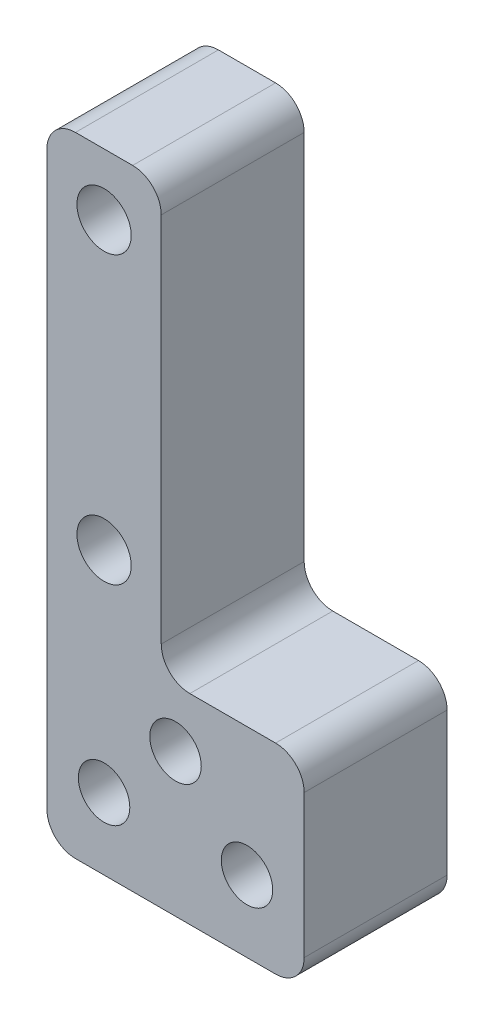
from build123d import *

# Parameters (mm, degrees)
SKETCH1_W           = 10.16
SKETCH1_H           = 38.1
SKETCH1_R           = 2.413
SKETCH1_R_2         = 2.286
BOSS_EXTRUDE1_DEPTH = 12.7
FILLET1_R           = 2.54


with BuildPart() as part:
    # Sketch1 → Boss-Extrude1 (new body)
    # profile 1 of 2: a face of its own
    with BuildSketch(Plane.XY):
        with Locations((0, -13.589)):
            Rectangle(SKETCH1_W, SKETCH1_H)
        with Locations((0, -25.4)):
            Circle(SKETCH1_R, mode=Mode.SUBTRACT)
        Circle(SKETCH1_R, mode=Mode.SUBTRACT)
    # profile 2 of 2: a face of its own
    with BuildSketch(Plane.XY):
        Polygon((5.08, -32.639), (-5.08, -32.639), (-5.08, -50.419), (17.78, -50.419), (17.78, -32.639), align=None)
        with Locations((0, -44.069)):
            Circle(SKETCH1_R_2, mode=Mode.SUBTRACT)
        with Locations((6.35, -37.719)):
            Circle(SKETCH1_R_2, mode=Mode.SUBTRACT)
        with Locations((12.7, -44.069)):
            Circle(SKETCH1_R_2, mode=Mode.SUBTRACT)
    extrude(amount=BOSS_EXTRUDE1_DEPTH)

    # Fillet1
    fillet1_edges = [part.edges().sort_by_distance(p)[0] for p in [
        (17.78, -50.419, 6.35),
        (-5.08, -50.419, 6.35),
        (-5.08, 5.461, 6.35),
        (5.08, 5.461, 6.35),
        (5.08, -32.639, 6.35),
        (17.78, -32.639, 6.35),
    ]]
    fillet(fillet1_edges, radius=FILLET1_R)


solid = part.part
